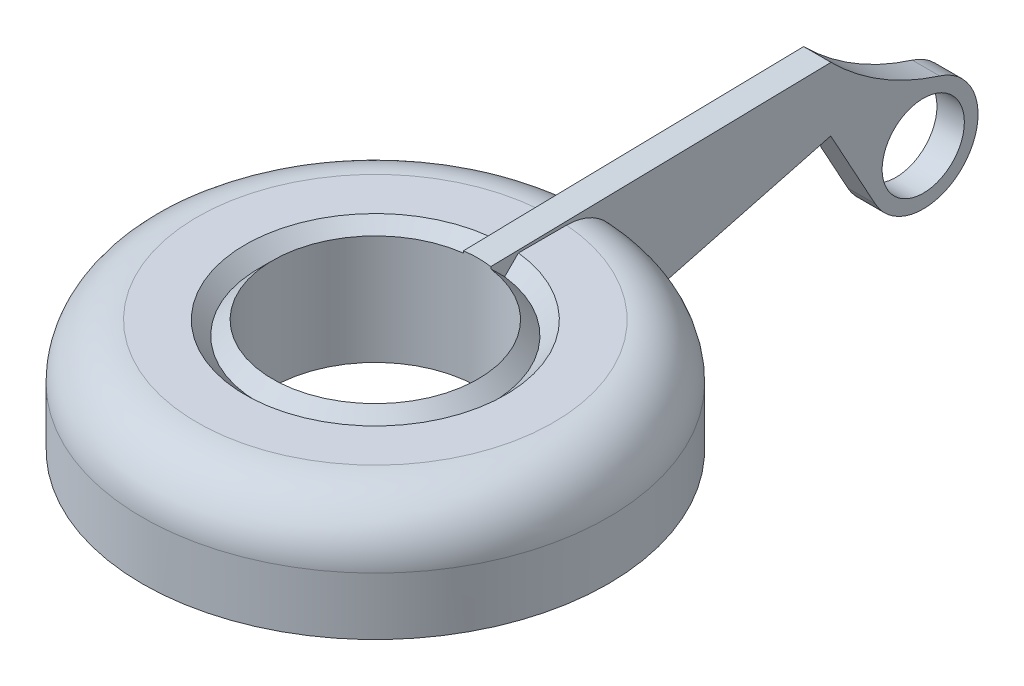
from build123d import *

# Parameters (mm, degrees)
FILLET1_R                = 2
SKETCH5_R                = 8.5
SKETCH5_R_2              = 7
BOSS_EXTRUDE1_DEPTH      = 0.1
BOSS_EXTRUDE2_DEPTH      = 0.5
BOSS_EXTRUDE2_DEPTH_BACK = 0.5
SKETCH6_R                = 1.5
CUT_EXTRUDE1_DEPTH       = 24.885141976
CUT_EXTRUDE1_DEPTH_BACK  = 24.885141976
SKETCH7_R                = 3.75


with BuildPart() as part:
    # Sketch4 → Revolve1 (revolve)
    with BuildSketch(Plane(origin=(0, 0, 0), x_dir=(0, 0, -1), z_dir=(1, 0, 0))):
        Polygon((0, 0), (-3.75, 0), (-4.25, -0.5), (-4.75, 0), (-8.5, 0), (-8.5, -4), (0, -4), align=None)
    revolve(axis=Axis((0, 1.890471386, 0), (0, -1, 0)))

    # Fillet1
    fillet1_edges = [part.edges().sort_by_distance(p)[0] for p in [
        (0, 0, -8.5),
    ]]
    fillet(fillet1_edges, radius=FILLET1_R)



with BuildPart() as body_2:
    # Sketch5 → Boss-Extrude1 (new body)
    with BuildSketch(Plane.XZ.offset(4)):
        Circle(SKETCH5_R)
        Circle(SKETCH5_R_2, mode=Mode.SUBTRACT)
    extrude(amount=BOSS_EXTRUDE1_DEPTH)


with BuildPart() as part_1:
    add(part.part)

    add(body_2.part)  # Boss-Extrude2 merges body 2
    # Sketch6 → Boss-Extrude2 (add, two sides: drawn at the far end of the back side and taken through both)
    with BuildSketch(Plane(origin=(0, 0, 0), x_dir=(0, 0, -1), z_dir=(1, 0, 0)).offset(-BOSS_EXTRUDE2_DEPTH_BACK)):
        with BuildLine():
            Line((16.132863069, 0.320027848), (0, 0))
            Line((0, 0), (0, -0.907670556))
            Line((0, -0.907670556), (7.174444166, -0.907670556))
            Line((7.174444166, -0.907670556), (8.5, -4))
            Line((8.5, -4), (16.12184584, -1.999779955))
            Line((16.12184584, -1.999779955), (17.746442499, -4.961787965))
            ThreePointArc((17.746442499, -4.961787965), (21.046890478, -5.267726252), (20.098589091, -2.09167846))
            ThreePointArc((20.098589091, -2.09167846), (17.968839585, -1.127360353), (16.132863069, 0.320027848))
        make_face()
        with Locations((19.5, -4)):
            Circle(SKETCH6_R, mode=Mode.SUBTRACT)
    extrude(amount=BOSS_EXTRUDE2_DEPTH + BOSS_EXTRUDE2_DEPTH_BACK)

    # Sketch7 → Cut-Extrude1 (cut, two sides: drawn at the far end of the back side and taken through both)
    with BuildSketch(Plane(origin=(0, 0, 0), x_dir=(1, 0, 0), z_dir=(0, 1, 0)).offset(-CUT_EXTRUDE1_DEPTH_BACK)):
        Circle(SKETCH7_R)
    extrude(amount=CUT_EXTRUDE1_DEPTH + CUT_EXTRUDE1_DEPTH_BACK, mode=Mode.SUBTRACT)


solid = part_1.part
